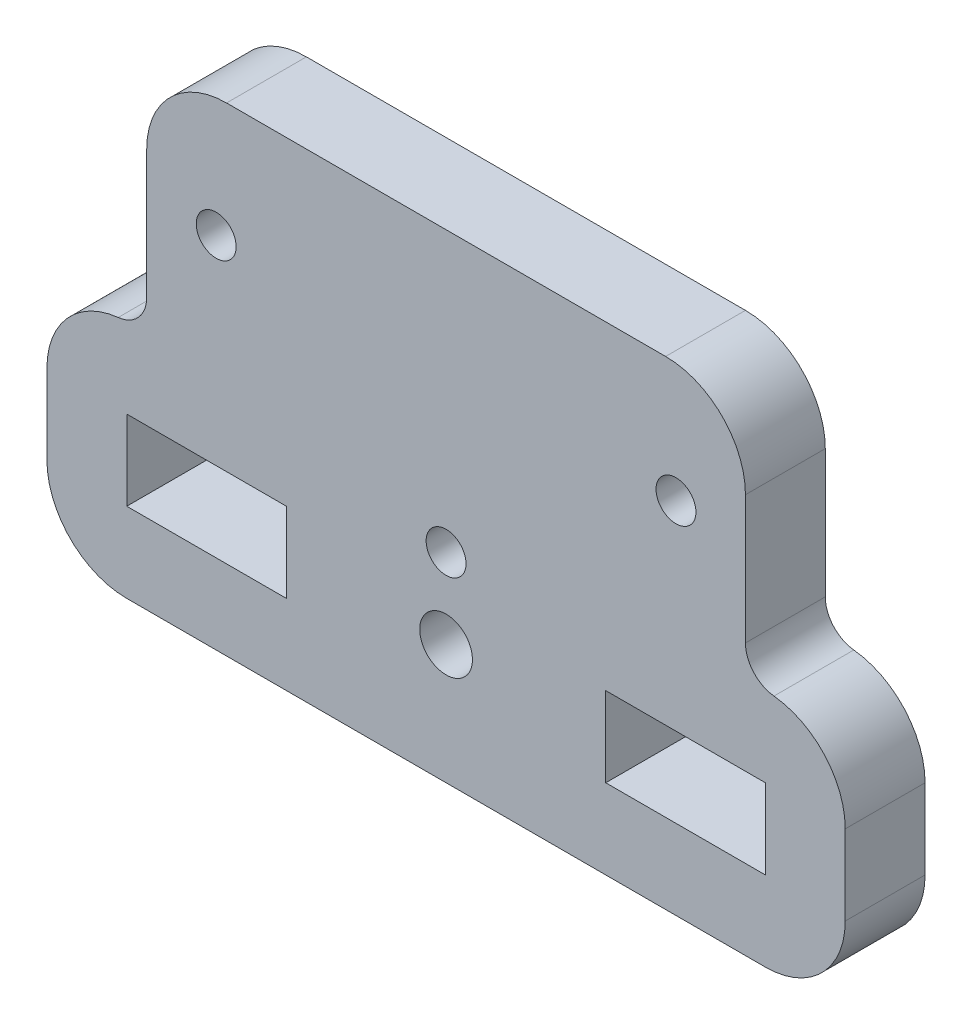
from build123d import *

# Parameters (mm, degrees)
SKETCH1_W           = 63.5
SKETCH1_H           = 19.05
BOSS_EXTRUDE1_DEPTH = 6.35
SKETCH2_R           = 2.0955
CUT_EXTRUDE1_DEPTH  = 34.750712955
SKETCH3_W           = 12.7
SKETCH3_H           = 6.35
CUT_EXTRUDE2_DEPTH  = 34.750712955
SKETCH4_W           = 47.625
SKETCH4_H           = 19.05
BOSS_EXTRUDE2_DEPTH = 6.35
SKETCH5_R           = 1.5875
CUT_EXTRUDE3_DEPTH  = 44.184668865
SKETCH6_R           = 1.5875
CUT_EXTRUDE4_DEPTH  = 44.184668865
FILLET3_R           = 6.35
FILLET4_R           = 2.54


with BuildPart() as part:
    # Sketch1 → Boss-Extrude1 (new body)
    with BuildSketch(Plane.XY):
        Rectangle(SKETCH1_W, SKETCH1_H)
    extrude(amount=BOSS_EXTRUDE1_DEPTH)

    # Sketch2 → Cut-Extrude1 (cut, through all)
    with BuildSketch(Plane.XY.offset(6.35)):
        Circle(SKETCH2_R)
    extrude(amount=-CUT_EXTRUDE1_DEPTH, mode=Mode.SUBTRACT)

    # Sketch3 → Cut-Extrude2 (cut, through all)
    with BuildSketch(Plane.XY.offset(6.35)):
        with Locations((-19.05, 0)):
            Rectangle(SKETCH3_W, SKETCH3_H)
    cut_extrude2 = extrude(amount=-CUT_EXTRUDE2_DEPTH, mode=Mode.SUBTRACT)

    # Mirror1: Cut-Extrude2 across plane
    add(cut_extrude2.mirror(Plane(origin=(0, 0, 0), x_dir=(0, 0, 1), z_dir=(1, 0, 0))), mode=Mode.SUBTRACT)

    # Sketch4 → Boss-Extrude2 (add)
    with BuildSketch(Plane.XY.offset(6.35)):
        with Locations((0, 19.05)):
            Rectangle(SKETCH4_W, SKETCH4_H)
    extrude(amount=-BOSS_EXTRUDE2_DEPTH)

    # Sketch5 → Cut-Extrude3 (cut, through all)
    with BuildSketch(Plane.XY.offset(6.35)):
        with Locations((-18.288, 19.05)):
            Circle(SKETCH5_R)
    cut_extrude3 = extrude(amount=-CUT_EXTRUDE3_DEPTH, mode=Mode.SUBTRACT)

    # Mirror2: Cut-Extrude3 across plane
    add(cut_extrude3.mirror(Plane(origin=(0, 0, 0), x_dir=(0, 0, 1), z_dir=(1, 0, 0))), mode=Mode.SUBTRACT)

    # Sketch6 → Cut-Extrude4 (cut, through all)
    with BuildSketch(Plane.XY.offset(6.35)):
        with Locations((0, 6.35)):
            Circle(SKETCH6_R)
    extrude(amount=-CUT_EXTRUDE4_DEPTH, mode=Mode.SUBTRACT)

    # Fillet3
    fillet3_edges = [part.edges().sort_by_distance(p)[0] for p in [
        (23.8125, 28.575, 3.175),
        (-23.8125, 28.575, 3.175),
        (31.75, -9.525, 3.175),
        (-31.75, -9.525, 3.175),
        (-31.75, 9.525, 3.175),
        (31.75, 9.525, 3.175),
    ]]
    fillet(fillet3_edges, radius=FILLET3_R)

    # Fillet4
    fillet4_edges = [part.edges().sort_by_distance(p)[0] for p in [
        (23.8125, 9.525, 3.175),
        (-23.8125, 9.525, 3.175),
    ]]
    fillet(fillet4_edges, radius=FILLET4_R)


solid = part.part
